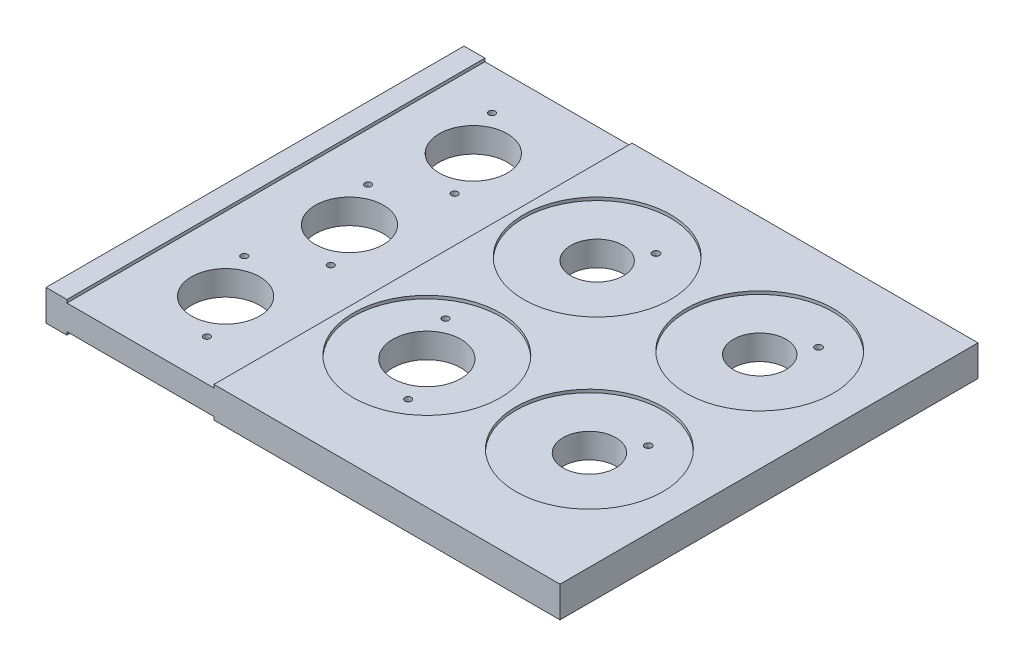
from build123d import *

# Parameters (mm, degrees)
SKETCH_1_W          = 332
SKETCH_1_H          = 270
EXTRUDE_1_DEPTH     = 20
SKETCH_2_W          = 95
SKETCH_2_H          = 289.731204414
CUT_EXTRUDE_1_DEPTH = 2
SKETCH_3_W          = 95
SKETCH_3_H          = 289.731204414
CUT_EXTRUDE_2_DEPTH = 2
CUT_EXTRUDE_3_REACH = 216.898
SKETCH_4_R          = 17
SKETCH_4_R_2        = 22
SKETCH_5_R          = 47.5
CUT_EXTRUDE_4_DEPTH = 2
CUT_EXTRUDE_START   = -2
SKETCH_6_R          = 47.5
CUT_EXTRUDE_5_DEPTH = 2
SKETCH_8_R          = 2.1
CUT_EXTRUDE_6_DEPTH = 12
SKETCH_9_R          = 2.25
CUT_EXTRUDE_7_DEPTH = 5


with BuildPart() as part:
    # 草图1 → 凸台-拉伸1 (new body)
    with BuildSketch(Plane(origin=(0, 0, 0), x_dir=(1, 0, 0), z_dir=(0, 1, 0))):
        Rectangle(SKETCH_1_W, SKETCH_1_H)
    extrude(amount=EXTRUDE_1_DEPTH)

    # 草图2 → 切除-拉伸1 (cut)
    with BuildSketch(Plane(origin=(0, 20, 0), x_dir=(1, 0, 0), z_dir=(0, 1, 0))):
        with Locations((-105, -0.900905486)):
            Rectangle(SKETCH_2_W, SKETCH_2_H)
    extrude(amount=-CUT_EXTRUDE_1_DEPTH, mode=Mode.SUBTRACT)

    # 草图3 → 切除-拉伸2 (cut)
    with BuildSketch(Plane.XZ):
        with Locations((-105, 0.900905486)):
            Rectangle(SKETCH_3_W, SKETCH_3_H)
    extrude(amount=-CUT_EXTRUDE_2_DEPTH, mode=Mode.SUBTRACT)

    # 草图4 → 切除-拉伸3 (cut, up to next)
    with BuildSketch(Plane(origin=(0, 20, 0), x_dir=(1, 0, 0), z_dir=(0, 1, 0)), mode=Mode.PRIVATE) as cut_extrude_3_sk1:
        with Locations(Location((-5, 60, 0), (0, 0, 270))):
            Circle(SKETCH_4_R)
    cut_extrude_3_tool1 = extrude(cut_extrude_3_sk1.sketch, amount=-CUT_EXTRUDE_3_REACH, mode=Mode.PRIVATE) & part.part
    # 草图4 → 切除-拉伸3 (cut, up to next)
    with BuildSketch(Plane(origin=(0, 20, 0), x_dir=(1, 0, 0), z_dir=(0, 1, 0)), mode=Mode.PRIVATE) as cut_extrude_3_sk2:
        with Locations(Location((-5, -50, 0), (0, 0, 270))):
            Circle(SKETCH_4_R_2)
    cut_extrude_3_tool2 = extrude(cut_extrude_3_sk2.sketch, amount=-CUT_EXTRUDE_3_REACH, mode=Mode.PRIVATE) & part.part
    # 草图4 → 切除-拉伸3 (cut, up to next)
    with BuildSketch(Plane(origin=(0, 20, 0), x_dir=(1, 0, 0), z_dir=(0, 1, 0)), mode=Mode.PRIVATE) as cut_extrude_3_sk3:
        with Locations(Location((100, -50, 0), (0, 0, 270))):
            Circle(SKETCH_4_R)
    cut_extrude_3_tool3 = extrude(cut_extrude_3_sk3.sketch, amount=-CUT_EXTRUDE_3_REACH, mode=Mode.PRIVATE) & part.part
    # 草图4 → 切除-拉伸3 (cut, up to next)
    with BuildSketch(Plane(origin=(0, 20, 0), x_dir=(1, 0, 0), z_dir=(0, 1, 0)), mode=Mode.PRIVATE) as cut_extrude_3_sk4:
        with Locations(Location((100, 60, 0), (0, 0, 270))):
            Circle(SKETCH_4_R)
    cut_extrude_3_tool4 = extrude(cut_extrude_3_sk4.sketch, amount=-CUT_EXTRUDE_3_REACH, mode=Mode.PRIVATE) & part.part
    # 草图4 → 切除-拉伸3 (cut, up to next)
    with BuildSketch(Plane(origin=(0, 20, 0), x_dir=(1, 0, 0), z_dir=(0, 1, 0)), mode=Mode.PRIVATE) as cut_extrude_3_sk5:
        with Locations(Location((-105, 80, 0), (0, 0, 270))):
            Circle(SKETCH_4_R_2)
    cut_extrude_3_tool5 = extrude(cut_extrude_3_sk5.sketch, amount=-CUT_EXTRUDE_3_REACH, mode=Mode.PRIVATE) & part.part
    # 草图4 → 切除-拉伸3 (cut, up to next)
    with BuildSketch(Plane(origin=(0, 20, 0), x_dir=(1, 0, 0), z_dir=(0, 1, 0)), mode=Mode.PRIVATE) as cut_extrude_3_sk6:
        with Locations(Location((-105, 0, 0), (0, 0, 270))):
            Circle(SKETCH_4_R_2)
    cut_extrude_3_tool6 = extrude(cut_extrude_3_sk6.sketch, amount=-CUT_EXTRUDE_3_REACH, mode=Mode.PRIVATE) & part.part
    # 草图4 → 切除-拉伸3 (cut, up to next)
    with BuildSketch(Plane(origin=(0, 20, 0), x_dir=(1, 0, 0), z_dir=(0, 1, 0)), mode=Mode.PRIVATE) as cut_extrude_3_sk7:
        with Locations(Location((-105, -80, 0), (0, 0, 270))):
            Circle(SKETCH_4_R_2)
    cut_extrude_3_tool7 = extrude(cut_extrude_3_sk7.sketch, amount=-CUT_EXTRUDE_3_REACH, mode=Mode.PRIVATE) & part.part
    add(cut_extrude_3_tool1.solids().sort_by_distance((-5, 20, -60))[0], mode=Mode.SUBTRACT)
    add(cut_extrude_3_tool2.solids().sort_by_distance((-5, 20, 50))[0], mode=Mode.SUBTRACT)
    add(cut_extrude_3_tool3.solids().sort_by_distance((100, 20, 50))[0], mode=Mode.SUBTRACT)
    add(cut_extrude_3_tool4.solids().sort_by_distance((100, 20, -60))[0], mode=Mode.SUBTRACT)
    add(cut_extrude_3_tool5.solids().sort_by_distance((-105, 20, -80))[0], mode=Mode.SUBTRACT)
    add(cut_extrude_3_tool6.solids().sort_by_distance((-105, 20, 0))[0], mode=Mode.SUBTRACT)
    add(cut_extrude_3_tool7.solids().sort_by_distance((-105, 20, 80))[0], mode=Mode.SUBTRACT)

    # 草图5 → 切除-拉伸4 (cut)
    with BuildSketch(Plane(origin=(0, 20, 0), x_dir=(1, 0, 0), z_dir=(0, 1, 0))):
        with Locations(Location((-5, 60, 0), (0, 0, 270))):
            Circle(SKETCH_5_R)
        with Locations(Location((100, 60, 0), (0, 0, 270))):
            Circle(SKETCH_5_R)
        with Locations(Location((100, -50, 0), (0, 0, 270))):
            Circle(SKETCH_5_R)
        with Locations(Location((-5, -50, 0), (0, 0, 270))):
            Circle(SKETCH_5_R)
    extrude(amount=-CUT_EXTRUDE_4_DEPTH, mode=Mode.SUBTRACT)

    # 草图6 → 切除-拉伸5 (cut)
    with BuildSketch(Plane.XZ.offset(CUT_EXTRUDE_START)):
        with Locations(Location((-5, -60, 0), (0, 0, 90))):
            Circle(SKETCH_6_R)
        with Locations(Location((100, -60, 0), (0, 0, 90))):
            Circle(SKETCH_6_R)
        with Locations(Location((100, 50, 0), (0, 0, 90))):
            Circle(SKETCH_6_R)
        with Locations(Location((-5, 50, 0), (0, 0, 90))):
            Circle(SKETCH_6_R)
    extrude(amount=CUT_EXTRUDE_5_DEPTH, mode=Mode.SUBTRACT)

    # 草图8 → 切除-拉伸6 (cut)
    with BuildSketch(Plane(origin=(0, 20, 0), x_dir=(1, 0, 0), z_dir=(0, 1, 0))):
        with Locations(Location((11.5, -78.578838325, 0), (0, 0, 270))):
            Circle(SKETCH_8_R)
        with Locations(Location((-21.5, -21.421161675, 0), (0, 0, 270))):
            Circle(SKETCH_8_R)
        with Locations(Location((-88.5, -108.578838325, 0), (0, 0, 270))):
            Circle(SKETCH_8_R)
        with Locations(Location((-88.5, -28.578838325, 0), (0, 0, 270))):
            Circle(SKETCH_8_R)
        with Locations(Location((-88.5, 51.421161675, 0), (0, 0, 270))):
            Circle(SKETCH_8_R)
        with Locations(Location((-121.5, 108.578838325, 0), (0, 0, 270))):
            Circle(SKETCH_8_R)
        with Locations(Location((-121.5, 28.578838325, 0), (0, 0, 270))):
            Circle(SKETCH_8_R)
        with Locations(Location((-121.5, -51.421161675, 0), (0, 0, 270))):
            Circle(SKETCH_8_R)
    extrude(amount=-CUT_EXTRUDE_6_DEPTH, mode=Mode.SUBTRACT)

    # 草图9 → 切除-拉伸7 (cut)
    with BuildSketch(Plane(origin=(0, 20, 0), x_dir=(1, 0, 0), z_dir=(0, 1, 0))):
        with Locations(Location((10, 83, 0), (0, 0, 270))):
            Circle(SKETCH_9_R)
        with Locations(Location((115, 83, 0), (0, 0, 270))):
            Circle(SKETCH_9_R)
        with Locations(Location((115, -27, 0), (0, 0, 270))):
            Circle(SKETCH_9_R)
    extrude(amount=-CUT_EXTRUDE_7_DEPTH, mode=Mode.SUBTRACT)


solid = part.part
